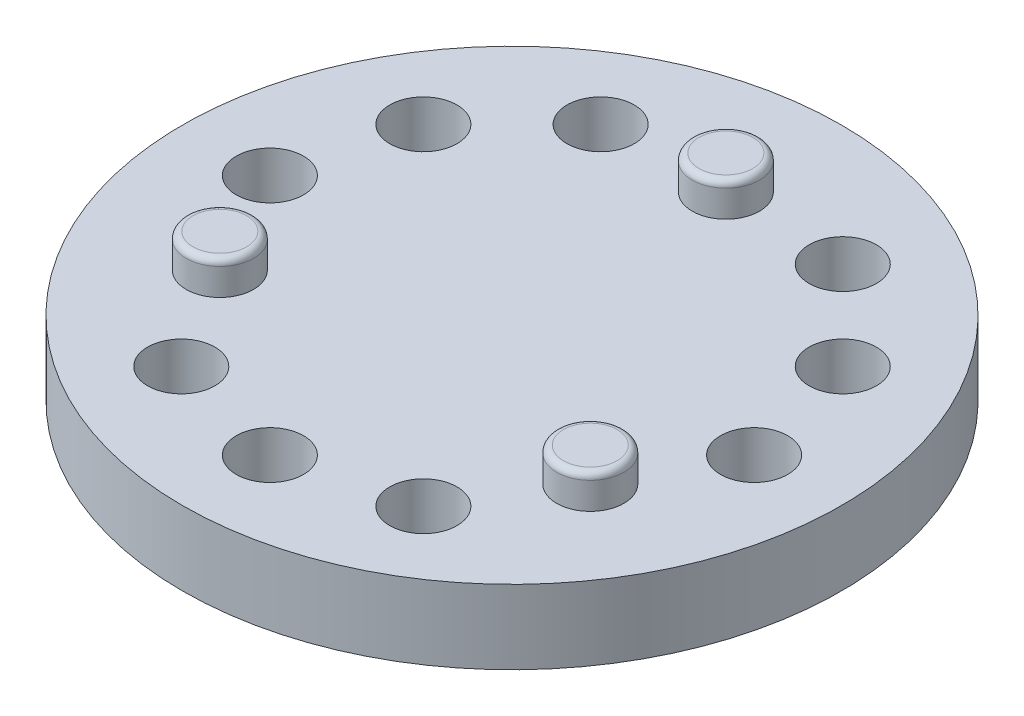
from build123d import *

# Parameters (mm, degrees)
SKETCH1_R           = 24.5
BOSS_EXTRUDE1_DEPTH = 5.5
SKETCH2_R           = 2.5
CUT_EXTRUDE1_DEPTH  = 6.6
SKETCH6_R           = 2.5
BOSS_EXTRUDE2_DEPTH = 2.5
FILLET1_R           = 0.5


with BuildPart() as part:
    # Sketch1 → Boss-Extrude1 (new body)
    with BuildSketch(Plane(origin=(0, 0, 0), x_dir=(1, 0, 0), z_dir=(0, 1, 0))):
        with Locations(Location((0, 0, 0), (0, 0, 270))):
            Circle(SKETCH1_R)
    extrude(amount=BOSS_EXTRUDE1_DEPTH)

    # Sketch2 → Cut-Extrude1 (cut)
    with BuildSketch(Plane(origin=(0, 5.5, 0), x_dir=(1, 0, 0), z_dir=(0, 1, 0))):
        with Locations(Location((-9, -15.588457268, 0), (0, 0, 270))):
            Circle(SKETCH2_R)
        with Locations(Location((-15.588457268, 9, 0), (0, 0, 270))):
            Circle(SKETCH2_R)
        with Locations(Location((-18, 0, 0), (0, 0, 270))):
            Circle(SKETCH2_R)
        with Locations(Location((0, -18, 0), (0, 0, 270))):
            Circle(SKETCH2_R)
        with Locations(Location((9, -15.588457268, 0), (0, 0, 270))):
            Circle(SKETCH2_R)
        with Locations(Location((-9, 15.588457268, 0), (0, 0, 270))):
            Circle(SKETCH2_R)
        with Locations(Location((9, 15.588457268, 0), (0, 0, 270))):
            Circle(SKETCH2_R)
        with Locations(Location((15.588457268, 9, 0), (0, 0, 270))):
            Circle(SKETCH2_R)
        with Locations(Location((18, 0, 0), (0, 0, 270))):
            Circle(SKETCH2_R)
    extrude(amount=-CUT_EXTRUDE1_DEPTH, mode=Mode.SUBTRACT)

    # Sketch6 → Boss-Extrude2 (add)
    with BuildSketch(Plane(origin=(0, 5.5, 0), x_dir=(1, 0, 0), z_dir=(0, 1, 0))):
        with Locations(Location((0, 15.9, 0), (0, 0, 270))):
            Circle(SKETCH6_R)
        with Locations(Location((13.76980392, -7.95, 0), (0, 0, 270))):
            Circle(SKETCH6_R)
        with Locations(Location((-13.76980392, -7.95, 0), (0, 0, 270))):
            Circle(SKETCH6_R)
    extrude(amount=BOSS_EXTRUDE2_DEPTH)

    # Fillet1
    fillet1_edges = [part.edges().sort_by_distance(p)[0] for p in [
        (0, 8, -18.4),
        (13.76980392, 8, 5.45),
        (-13.76980392, 8, 5.45),
    ]]
    fillet(fillet1_edges, radius=FILLET1_R)


solid = part.part
